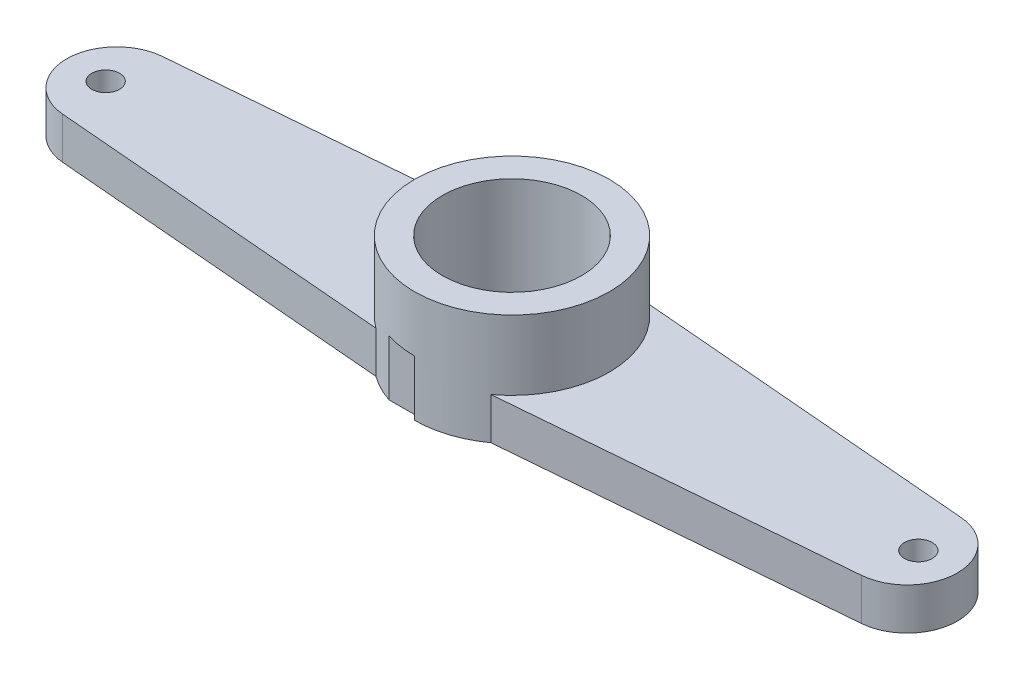
from build123d import *

# Parameters (mm, degrees)
EXTRUDE_1_DEPTH     = 1.5
EXTRUDE_1_2_DEPTH   = 1.5
SKETCH_1_4_R        = 3.499752311
EXTRUDE_2_DEPTH     = 4
SKETCH_2_R          = 2.5
CUT_EXTRUDE_1_DEPTH = 4
SKETCH_3_R          = 0.5
CUT_EXTRUDE_2_DEPTH = 4
CUT_EXTRUDE_3_DEPTH = 2
SKETCH_5_W          = 2
SKETCH_5_H          = 2
EXTRUDE_3_DEPTH     = 1


with BuildPart() as part:
    # 草图1 → 凸台-拉伸1 (new body)
    with BuildSketch(Plane(origin=(0, 0, 0), x_dir=(1, 0, 0), z_dir=(0, 1, 0))):
        with BuildLine():
            Line((2.063744522, -2.826521676), (14.350776204, -1.793674033))
            ThreePointArc((14.350776204, -1.793674033), (16, 0), (14.350776204, 1.793674033))
            Line((14.350776204, 1.793674033), (2.063744522, 2.826521676))
            ThreePointArc((2.063744522, 2.826521676), (3.499752311, 0), (2.063744522, -2.826521676))
        make_face()
    extrude(amount=EXTRUDE_1_DEPTH)



with BuildPart() as body_2:
    # 草图1 → Extrude 1 2 (new body)
    with BuildSketch(Plane(origin=(0, 0, 0), x_dir=(1, 0, 0), z_dir=(0, 1, 0))):
        with BuildLine():
            ThreePointArc((-2.063744522, -2.826521676), (-3.499752311, 0), (-2.063744522, 2.826521676))
            Line((-2.063744522, 2.826521676), (-14.350776204, 1.793674033))
            ThreePointArc((-14.350776204, 1.793674033), (-16, 0), (-14.350776204, -1.793674033))
            Line((-14.350776204, -1.793674033), (-2.063744522, -2.826521676))
        make_face()
    extrude(amount=EXTRUDE_1_2_DEPTH)


with BuildPart() as part_1:
    add(part.part)

    add(body_2.part)  # 凸台-拉伸2 merges body 2
    # 草图1<4> → 凸台-拉伸2 (add)
    with BuildSketch(Plane(origin=(0, 0, 0), x_dir=(1, 0, 0), z_dir=(0, 1, 0))):
        Circle(SKETCH_1_4_R)
    extrude(amount=EXTRUDE_2_DEPTH)

    # 草图2 → 切除-拉伸1 (cut)
    with BuildSketch(Plane(origin=(0, 4, 0), x_dir=(1, 0, 0), z_dir=(0, 1, 0))):
        Circle(SKETCH_2_R)
    extrude(amount=-CUT_EXTRUDE_1_DEPTH, mode=Mode.SUBTRACT)

    # 草图3 → 切除-拉伸2 (cut)
    with BuildSketch(Plane.XZ):
        with Locations((14.6, 0)):
            Circle(SKETCH_3_R)
        with Locations((-14.6, 0)):
            Circle(SKETCH_3_R)
    extrude(amount=-CUT_EXTRUDE_2_DEPTH, mode=Mode.SUBTRACT)

    # 草图4 → 切除-拉伸3 (cut)
    with BuildSketch(Plane.XZ):
        with BuildLine():
            Line((-1.090127756, 3.325640948), (0, 3.317539819))
            Line((0, 3.317539819), (0, 3.499752311))
            ThreePointArc((0, 3.499752311), (-0.551972212, 3.455950363), (-1.090127756, 3.325640948))
        make_face()
    extrude(amount=-CUT_EXTRUDE_3_DEPTH, mode=Mode.SUBTRACT)


with BuildPart() as body_2_2:
    # 草图5 → 凸台-拉伸3 (new body)
    with BuildSketch(Plane.XZ):
        Rectangle(SKETCH_5_W, SKETCH_5_H)
    extrude(amount=EXTRUDE_3_DEPTH)


solid = Compound([part_1.part, body_2_2.part])
